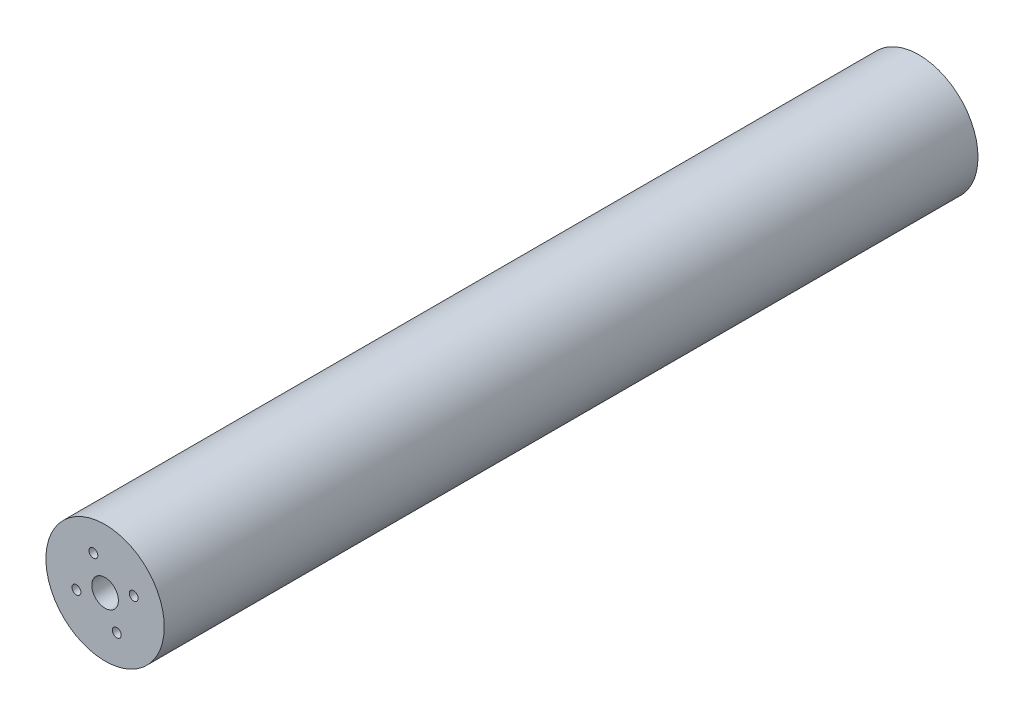
from build123d import *

# Parameters (mm, degrees)
SKETCH2_R           = 20
BOSS_EXTRUDE1_DEPTH = 275
SKETCH5_W           = 5
SKETCH5_H           = 9
CUT_EXTRUDE2_DEPTH  = 8
SKETCH8_W           = 4
SKETCH8_H           = 9
CUT_EXTRUDE3_DEPTH  = 4
CUT_EXTRUDE4_START  = 5
SKETCH8_4_W         = 4
SKETCH8_4_H         = 9
CUT_EXTRUDE4_DEPTH  = 4
SKETCH9_W           = 4
SKETCH9_H           = 13
CUT_EXTRUDE5_DEPTH  = 4
CUT_EXTRUDE6_START  = 9
CUT_EXTRUDE6_DEPTH  = 4
SKETCH10_R          = 4.5
CUT_EXTRUDE7_DEPTH  = 277.450718936
CIRPATTERN1_COUNT   = 4


with BuildPart() as part:
    # Sketch2 → Boss-Extrude1 (new body)
    with BuildSketch(Plane.XY):
        Circle(SKETCH2_R)
    extrude(amount=BOSS_EXTRUDE1_DEPTH)

    # Sketch5 → Cut-Extrude2 (cut)
    with BuildSketch(Plane.ZY.offset(20)):
        with Locations((13.5, 0)):
            Rectangle(SKETCH5_W, SKETCH5_H)
    extrude(amount=-CUT_EXTRUDE2_DEPTH, mode=Mode.SUBTRACT)

    # Sketch8 → Cut-Extrude3 (cut)
    with BuildSketch(Plane.XY.offset(11)):
        with Locations((-14, 0)):
            Rectangle(SKETCH8_W, SKETCH8_H)
    extrude(amount=-CUT_EXTRUDE3_DEPTH, mode=Mode.SUBTRACT)

    # Sketch8<4> → Cut-Extrude4 (cut)
    with BuildSketch(Plane.XY.offset(11).offset(CUT_EXTRUDE4_START)):
        with Locations((-14, 0)):
            Rectangle(SKETCH8_4_W, SKETCH8_4_H)
    extrude(amount=CUT_EXTRUDE4_DEPTH, mode=Mode.SUBTRACT)

    # Sketch9 → Cut-Extrude5 (cut)
    with BuildSketch(Plane.XZ.offset(-4.5)):
        with Locations((-14, 13.5)):
            Rectangle(SKETCH9_W, SKETCH9_H)
    extrude(amount=-CUT_EXTRUDE5_DEPTH, mode=Mode.SUBTRACT)

    # Sketch9<2> → Cut-Extrude6 (cut)
    with BuildSketch(Plane.XZ.offset(-4.5).offset(CUT_EXTRUDE6_START)):
        Polygon((-16, 16), (-16, 11), (-16, 7), (-12, 7), (-12, 20), (-16, 20), align=None)
    extrude(amount=CUT_EXTRUDE6_DEPTH, mode=Mode.SUBTRACT)

    # Sketch10 → Cut-Extrude7 (cut, through all)
    with BuildSketch(Plane(origin=(0, 0, 0), x_dir=(-1, 0, 0), z_dir=(0, 0, -1))):
        Circle(SKETCH10_R)
    extrude(amount=-CUT_EXTRUDE7_DEPTH, mode=Mode.SUBTRACT)

    # Sketch13 → Ø3.0 (3) Diameter Hole1 (revolve, cut)
    with BuildSketch(Plane(origin=(-3.955313085, 9.672538364, 275), x_dir=(0, -1, 0), z_dir=(1, 0, 0))):
        Polygon((0, 0), (0, 5.901290929), (1.5, 5), (1.5, 0), align=None)
    f_3_0_3_diameter_hole1 = revolve(axis=Axis((-3.955313085, 9.672538364, 281.35), (0, 0, -1)), mode=Mode.SUBTRACT)

    # CirPattern1: Ø3.0 (3) Diameter Hole1 ×4 about axis
    cirpattern1_axis = Axis((0, 0, 0), (0, 0, 1))
    for i in range(1, CIRPATTERN1_COUNT):
        add(f_3_0_3_diameter_hole1.rotate(cirpattern1_axis, i * 360 / CIRPATTERN1_COUNT), mode=Mode.SUBTRACT)


solid = part.part
